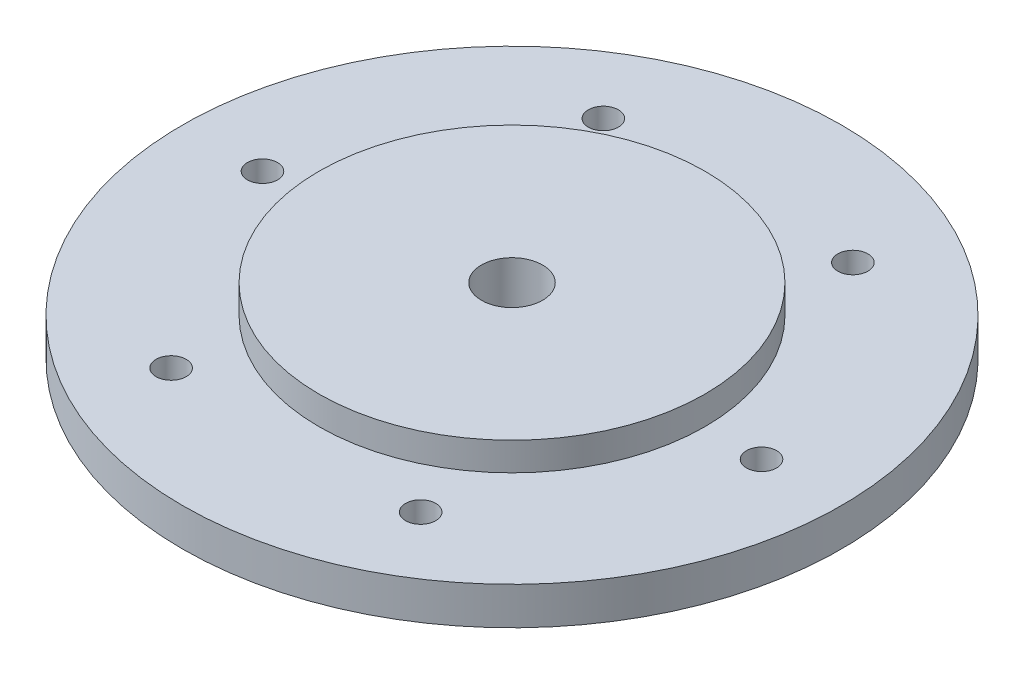
from build123d import *

# Parameters (mm, degrees)
SKETCH_1_R      = 35
SKETCH_1_R_2    = 1.6
SKETCH_1_R_3    = 17.5
EXTRUDE_1_DEPTH = 4
SKETCH_2_R      = 20.5
SKETCH_2_R_2    = 17.5
EXTRUDE_2_DEPTH = 3
EXTRUDE_START   = -3
SKETCH_3_R      = 17.5
SKETCH_3_R_2    = 3.25
EXTRUDE_3_DEPTH = 3
EXTRUDE_START_2 = 4
SKETCH_4_R      = 8.5
SKETCH_4_R_2    = 3.25
EXTRUDE_4_DEPTH = 4


with BuildPart() as part:
    # Эскиз1 → Бобышка-Вытянуть1 (new body)
    with BuildSketch(Plane(origin=(0, 0, 0), x_dir=(1, 0, 0), z_dir=(0, 1, 0))):
        with Locations(Location((0, 0, 0), (0, 0, 270))):
            Circle(SKETCH_1_R)
        with Locations(Location((-13.25, -22.9496732, 0), (0, 0, 270))):
            Circle(SKETCH_1_R_2, mode=Mode.SUBTRACT)
        with Locations(Location((13.25, -22.9496732, 0), (0, 0, 270))):
            Circle(SKETCH_1_R_2, mode=Mode.SUBTRACT)
        with Locations(Location((26.5, 0, 0), (0, 0, 270))):
            Circle(SKETCH_1_R_2, mode=Mode.SUBTRACT)
        with Locations(Location((13.25, 22.9496732, 0), (0, 0, 270))):
            Circle(SKETCH_1_R_2, mode=Mode.SUBTRACT)
        with Locations(Location((-13.25, 22.9496732, 0), (0, 0, 270))):
            Circle(SKETCH_1_R_2, mode=Mode.SUBTRACT)
        with Locations(Location((-26.5, 0, 0), (0, 0, 270))):
            Circle(SKETCH_1_R_2, mode=Mode.SUBTRACT)
        with Locations(Location((0, 0, 0), (0, 0, 270))):
            Circle(SKETCH_1_R_3, mode=Mode.SUBTRACT)
    extrude(amount=EXTRUDE_1_DEPTH)

    # Эскиз2 → Бобышка-Вытянуть2 (add)
    with BuildSketch(Plane(origin=(0, 4, 0), x_dir=(1, 0, 0), z_dir=(0, 1, 0))):
        with Locations(Location((0, 0, 0), (0, 0, 270))):
            Circle(SKETCH_2_R)
        with Locations(Location((0, 0, 0), (0, 0, 270))):
            Circle(SKETCH_2_R_2, mode=Mode.SUBTRACT)
    extrude(amount=EXTRUDE_2_DEPTH)

    # Эскиз3 → Бобышка-Вытянуть3 (add)
    with BuildSketch(Plane(origin=(0, 7, 0), x_dir=(1, 0, 0), z_dir=(0, 1, 0)).offset(EXTRUDE_START)):
        with Locations(Location((0, 0, 0), (0, 0, 270))):
            Circle(SKETCH_3_R)
        with Locations(Location((0, 0, 0), (0, 0, 270))):
            Circle(SKETCH_3_R_2, mode=Mode.SUBTRACT)
    extrude(amount=EXTRUDE_3_DEPTH)

    # Эскиз4 → Бобышка-Вытянуть4 (add)
    with BuildSketch(Plane.XZ.offset(-4).offset(EXTRUDE_START_2)):
        with Locations(Location((0, 0, 0), (0, 0, 90))):
            Circle(SKETCH_4_R)
        with Locations(Location((0, 0, 0), (0, 0, 90))):
            Circle(SKETCH_4_R_2, mode=Mode.SUBTRACT)
    extrude(amount=-EXTRUDE_4_DEPTH)


solid = part.part
